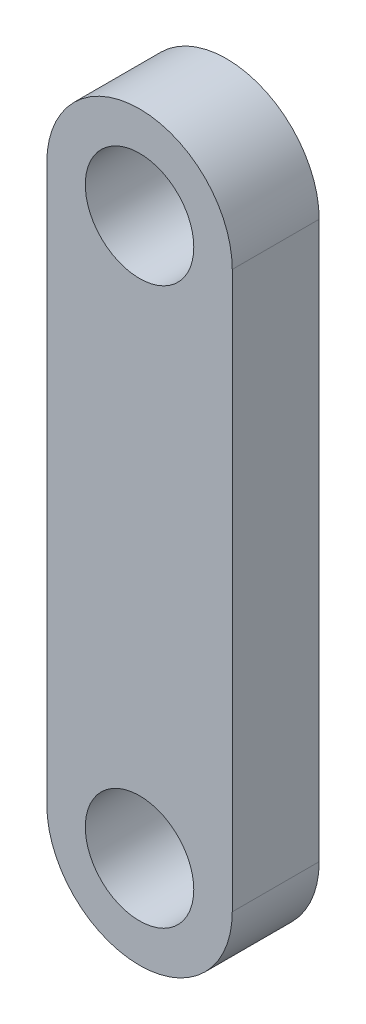
from build123d import *

# Parameters (mm, degrees)
SKETCH1_R           = 1.872
BOSS_EXTRUDE1_DEPTH = 3


with BuildPart() as part:
    # Sketch1 → Boss-Extrude1 (new body)
    with BuildSketch(Plane.XY):
        with BuildLine():
            Line((-3.2, 19.2), (-3.2, 0))
            ThreePointArc((-3.2, 0), (0, -3.2), (3.2, 0))
            Line((3.2, 0), (3.2, 19.2))
            ThreePointArc((3.2, 19.2), (0, 22.4), (-3.2, 19.2))
        make_face()
        Circle(SKETCH1_R, mode=Mode.SUBTRACT)
        with Locations((0, 19.2)):
            Circle(SKETCH1_R, mode=Mode.SUBTRACT)
    extrude(amount=BOSS_EXTRUDE1_DEPTH)


solid = part.part
